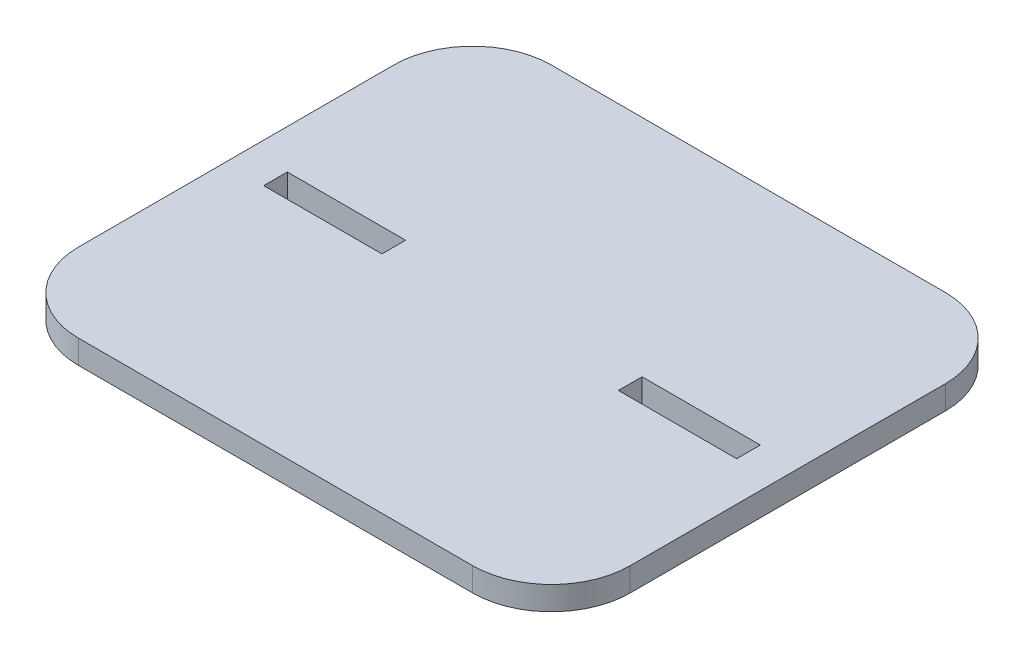
from build123d import *

# Parameters (mm, degrees)
SKETCH1_W           = 15
SKETCH1_H           = 3
BOSS_EXTRUDE1_DEPTH = 3


with BuildPart() as part:
    # Sketch1 → Boss-Extrude1 (new body)
    with BuildSketch(Plane(origin=(0, 0, 0), x_dir=(1, 0, 0), z_dir=(0, 1, 0))):
        with BuildLine():
            Line((10, 0), (60, 0))
            ThreePointArc((60, 0), (67.071067812, 2.928932188), (70, 10))
            Line((70, 10), (70, 50))
            ThreePointArc((70, 50), (67.071067812, 57.071067812), (60, 60))
            Line((60, 60), (10, 60))
            ThreePointArc((10, 60), (2.928932188, 57.071067812), (0, 50))
            Line((0, 50), (0, 10))
            ThreePointArc((0, 10), (2.928932188, 2.928932188), (10, 0))
        make_face()
        with Locations((12.5, 30)):
            Rectangle(SKETCH1_W, SKETCH1_H, mode=Mode.SUBTRACT)
        with Locations((57.5, 30)):
            Rectangle(SKETCH1_W, SKETCH1_H, mode=Mode.SUBTRACT)
    extrude(amount=BOSS_EXTRUDE1_DEPTH)


solid = part.part
